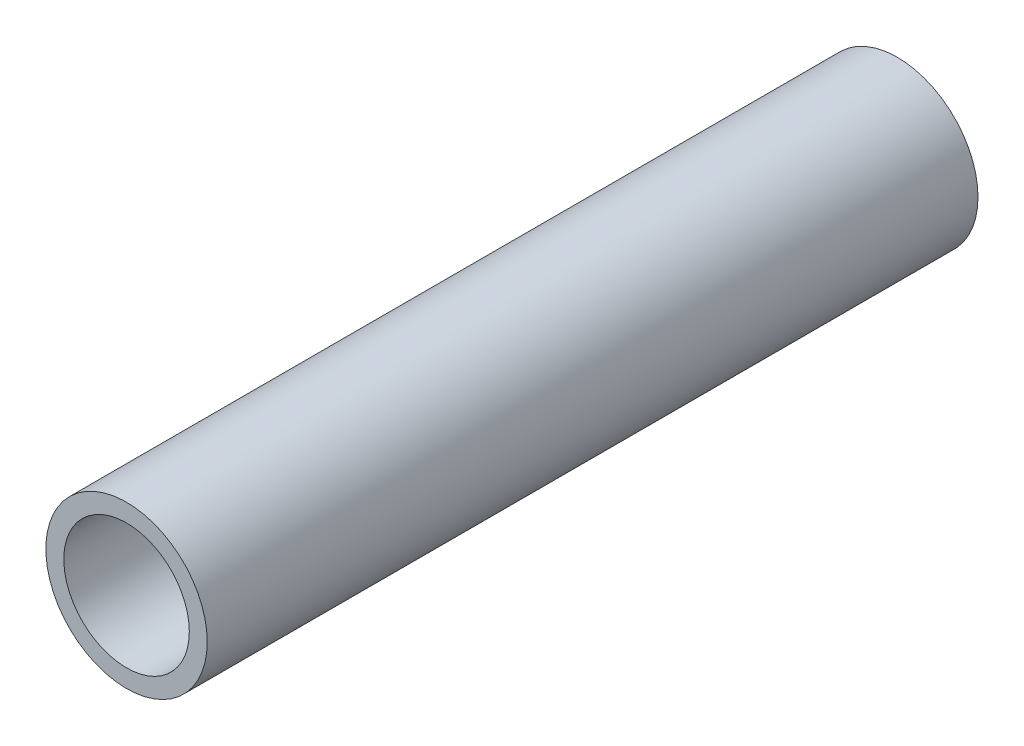
from build123d import *

# Parameters (mm, degrees)
SKETCH1_R           = 9
SKETCH1_R_2         = 7
BOSS_EXTRUDE1_DEPTH = 42.98


with BuildPart() as part:
    # Sketch1 → Boss-Extrude1 (new, symmetric)
    with BuildSketch(Plane.XY):
        Circle(SKETCH1_R)
        Circle(SKETCH1_R_2, mode=Mode.SUBTRACT)
    extrude(amount=BOSS_EXTRUDE1_DEPTH, both=True)


solid = part.part
